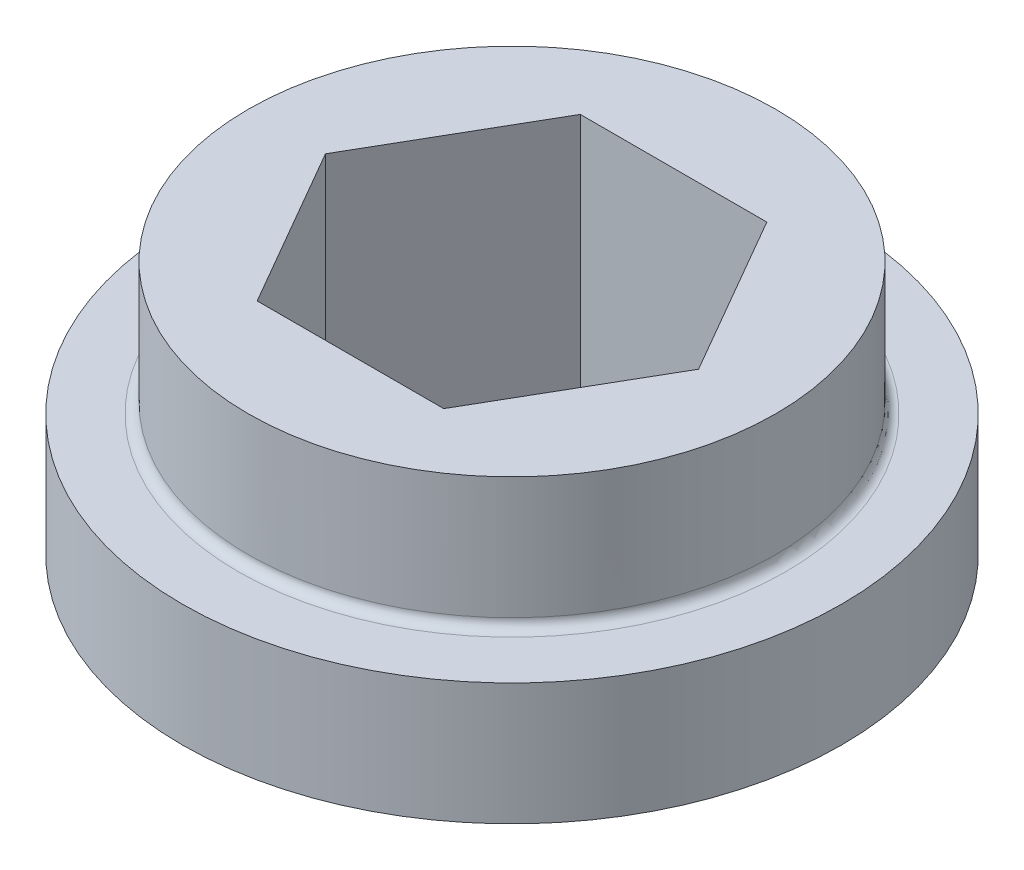
from build123d import *

# Parameters (mm, degrees)
SKETCH1_R           = 4
BOSS_EXTRUDE1_DEPTH = 2
SKETCH2_R           = 5
BOSS_EXTRUDE2_DEPTH = 1.85
FILLET1_R           = 0.15


with BuildPart() as part:
    # Sketch1 → Boss-Extrude1 (new body)
    with BuildSketch(Plane(origin=(0, 0, 0), x_dir=(1, 0, 0), z_dir=(0, 1, 0))):
        with Locations(Location((0, 0, 0), (0, 0, 270))):
            Circle(SKETCH1_R)
        Polygon((2.829016319, 0), (1.41450816, 2.45), (-1.41450816, 2.45), (-2.829016319, 0), (-1.41450816, -2.45), (1.41450816, -2.45), align=None, mode=Mode.SUBTRACT)
    extrude(amount=BOSS_EXTRUDE1_DEPTH)

    # Sketch2 → Boss-Extrude2 (add)
    with BuildSketch(Plane.XZ):
        with Locations(Location((0, 0, 0), (0, 0, 270))):
            Circle(SKETCH2_R)
        Polygon((2.829016319, 0), (1.41450816, 2.45), (-1.41450816, 2.45), (-2.829016319, 0), (-1.41450816, -2.45), (1.41450816, -2.45), align=None, mode=Mode.SUBTRACT)
    extrude(amount=BOSS_EXTRUDE2_DEPTH)

    # Fillet1
    fillet1_edges = [part.edges().sort_by_distance(p)[0] for p in [
        (0, 0, -4),
    ]]
    fillet(fillet1_edges, radius=FILLET1_R)


solid = part.part
